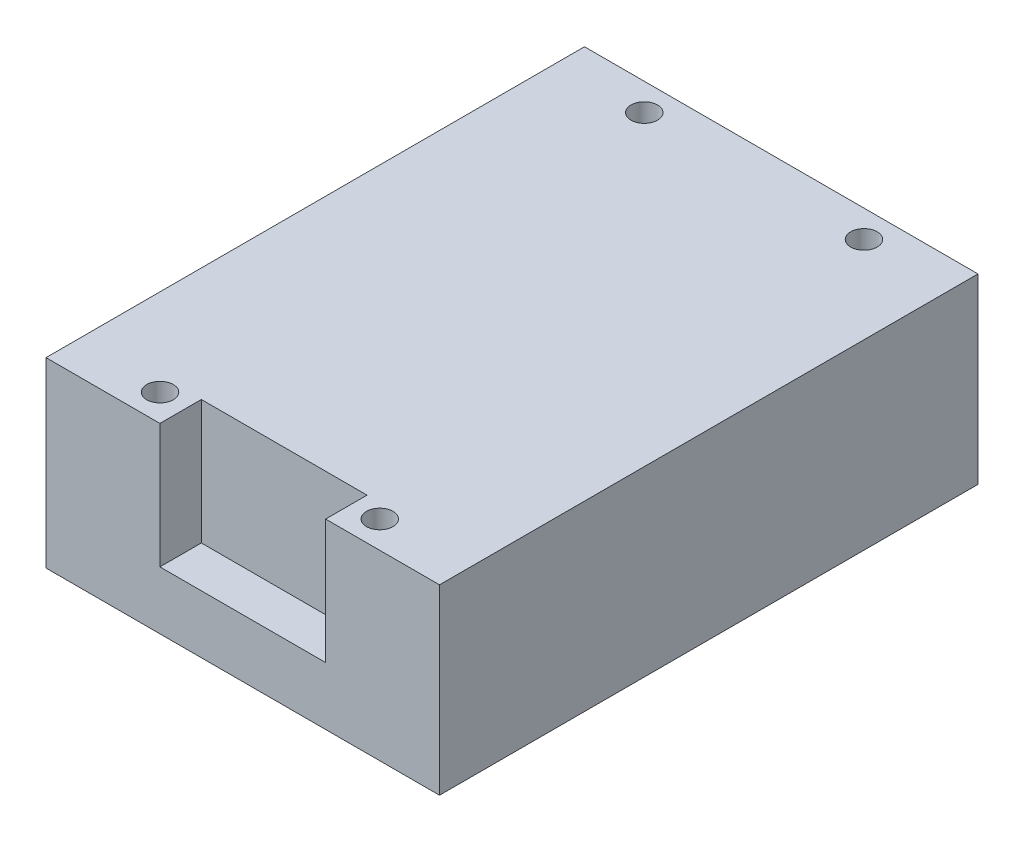
from build123d import *

# Parameters (mm, degrees)
SKETCH1_W           = 47.5
SKETCH1_H           = 65
BOSS_EXTRUDE1_DEPTH = 22
SKETCH2_R           = 1.6
CUT_EXTRUDE1_DEPTH  = 46.87278605
SKETCH4_W           = 20
SKETCH4_H           = 5
CUT_EXTRUDE2_DEPTH  = 15


with BuildPart() as part:
    # Sketch1 → Boss-Extrude1 (new body)
    with BuildSketch(Plane(origin=(0, 0, 0), x_dir=(1, 0, 0), z_dir=(0, 1, 0))):
        Rectangle(SKETCH1_W, SKETCH1_H)
    extrude(amount=BOSS_EXTRUDE1_DEPTH)

    # Sketch2 → Cut-Extrude1 (cut, through all)
    with BuildSketch(Plane(origin=(0, 22, 0), x_dir=(1, 0, 0), z_dir=(0, 1, 0))):
        with Locations(Location((-13.26, 29.225, 0), (0, 0, 270))):
            Circle(SKETCH2_R)
        with Locations(Location((13.26, 29.225, 0), (0, 0, 270))):
            Circle(SKETCH2_R)
        with Locations(Location((13.26, -29.225, 0), (0, 0, 270))):
            Circle(SKETCH2_R)
        with Locations(Location((-13.26, -29.225, 0), (0, 0, 270))):
            Circle(SKETCH2_R)
    extrude(amount=-CUT_EXTRUDE1_DEPTH, mode=Mode.SUBTRACT)

    # Sketch4 → Cut-Extrude2 (cut)
    with BuildSketch(Plane(origin=(0, 22, 0), x_dir=(1, 0, 0), z_dir=(0, 1, 0))):
        with Locations((0, -30)):
            Rectangle(SKETCH4_W, SKETCH4_H)
    extrude(amount=-CUT_EXTRUDE2_DEPTH, mode=Mode.SUBTRACT)


solid = part.part
